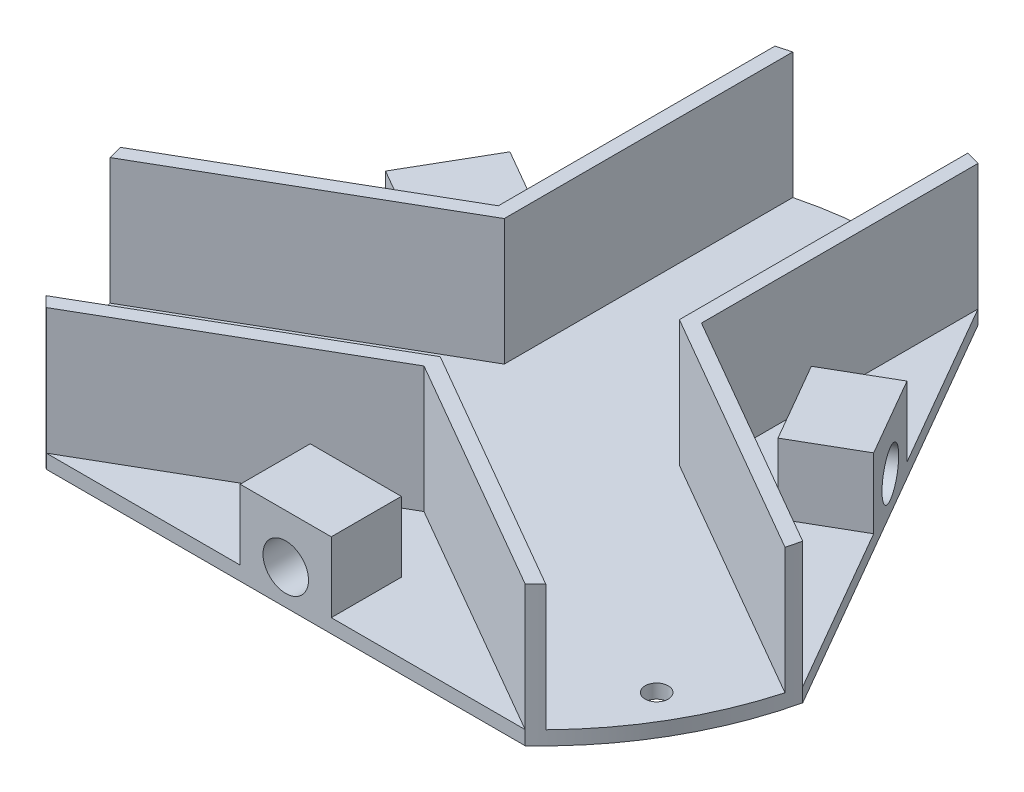
from build123d import *

# Parameters (mm, degrees)
SKETCH1_R           = 1.65
BOSS_EXTRUDE1_DEPTH = 2
BOSS_EXTRUDE2_DEPTH = 18
SKETCH3_W           = 13
SKETCH3_H           = 10
BOSS_EXTRUDE3_DEPTH = 10
SKETCH4_R           = 3.25
CUT_EXTRUDE1_DEPTH  = 10
CIRPATTERN1_COUNT   = 3


with BuildPart() as part:
    # Sketch1 → Boss-Extrude1 (new body)
    with BuildSketch(Plane(origin=(0, 0, 0), x_dir=(1, 0, 0), z_dir=(0, 1, 0))):
        with BuildLine():
            Line((14.5, 47.85133227), (48.690469351, -11.36829778))
            ThreePointArc((48.690469351, -11.36829778), (43.301270189, -25), (34.190469351, -36.48303449))
            Line((34.190469351, -36.48303449), (-34.190469351, -36.48303449))
            ThreePointArc((-34.190469351, -36.48303449), (-43.301270189, -25), (-48.690469351, -11.36829778))
            Line((-48.690469351, -11.36829778), (-14.5, 47.85133227))
            ThreePointArc((-14.5, 47.85133227), (0, 50), (14.5, 47.85133227))
        make_face()
        with Locations(Location((0, 45, 0), (0, 0, 270))):
            Circle(SKETCH1_R, mode=Mode.SUBTRACT)
        with Locations(Location((38.97114317, -22.5, 0), (0, 0, 270))):
            Circle(SKETCH1_R, mode=Mode.SUBTRACT)
        with Locations(Location((-38.97114317, -22.5, 0), (0, 0, 270))):
            Circle(SKETCH1_R, mode=Mode.SUBTRACT)
    extrude(amount=BOSS_EXTRUDE1_DEPTH)

    # Sketch2 → Boss-Extrude2 (add)
    with BuildSketch(Plane(origin=(0, 2, 0), x_dir=(1, 0, 0), z_dir=(0, 1, 0))):
        with BuildLine():
            Line((-14.5, 47.85133227), (-14.5, 8.371578903))
            Line((-14.5, 8.371578903), (-48.690469351, -11.36829778))
            ThreePointArc((-48.690469351, -11.36829778), (-48.443824061, -12.377233549), (-48.176274578, -13.380828366))
            Line((-48.176274578, -13.380828366), (-12.5, 7.216878365))
            Line((-12.5, 7.216878365), (-12.5, 48.412291828))
            ThreePointArc((-12.5, 48.412291828), (-13.502913349, 48.142199068), (-14.5, 47.85133227))
        make_face()
        with BuildLine():
            Line((14.5, 47.85133227), (14.5, 8.371578903))
            Line((14.5, 8.371578903), (48.690469351, -11.36829778))
            ThreePointArc((48.690469351, -11.36829778), (48.443824061, -12.377233549), (48.176274578, -13.380828366))
            Line((48.176274578, -13.380828366), (12.5, 7.216878365))
            Line((12.5, 7.216878365), (12.5, 48.412291828))
            ThreePointArc((12.5, 48.412291828), (13.502913349, 48.142199068), (14.5, 47.85133227))
        make_face()
        with BuildLine():
            Line((-34.190469351, -36.48303449), (0, -16.743157806))
            Line((0, -16.743157806), (34.190469351, -36.48303449))
            ThreePointArc((34.190469351, -36.48303449), (34.940910712, -35.764965519), (35.676274578, -35.031463461))
            Line((35.676274578, -35.031463461), (0, -14.43375673))
            Line((0, -14.43375673), (-35.676274578, -35.031463461))
            ThreePointArc((-35.676274578, -35.031463461), (-34.940910712, -35.764965519), (-34.190469351, -36.48303449))
        make_face()
    extrude(amount=BOSS_EXTRUDE2_DEPTH)

    # Sketch3 → Boss-Extrude3 (add)
    with BuildSketch(Plane(origin=(31.595234675, 0, -18.241517245), x_dir=(-0.5000000000000003, 0, -0.8660254037844386), z_dir=(0.8660254037844385, 0, -0.5000000000000002))):
        with Locations((0, 7)):
            Rectangle(SKETCH3_W, SKETCH3_H)
    boss_extrude3 = extrude(amount=-BOSS_EXTRUDE3_DEPTH)

    # Sketch4 → Cut-Extrude1 (cut)
    with BuildSketch(Plane(origin=(31.595234675, 0, -18.241517245), x_dir=(-0.5000000000000003, 0, -0.8660254037844385), z_dir=(0.8660254037844385, 0, -0.5000000000000003))):
        with Locations((0, 5)):
            Circle(SKETCH4_R)
    cut_extrude1 = extrude(amount=-CUT_EXTRUDE1_DEPTH, mode=Mode.SUBTRACT)

    # CirPattern1: Boss-Extrude3, Cut-Extrude1 ×3 about axis
    cirpattern1_axis = Axis((0, 0, 0), (0, 1, 0))
    add([boss_extrude3.rotate(cirpattern1_axis, i * 360 / CIRPATTERN1_COUNT) for i in range(1, CIRPATTERN1_COUNT)])
    add([cut_extrude1.rotate(cirpattern1_axis, i * 360 / CIRPATTERN1_COUNT) for i in range(1, CIRPATTERN1_COUNT)], mode=Mode.SUBTRACT)


solid = part.part
